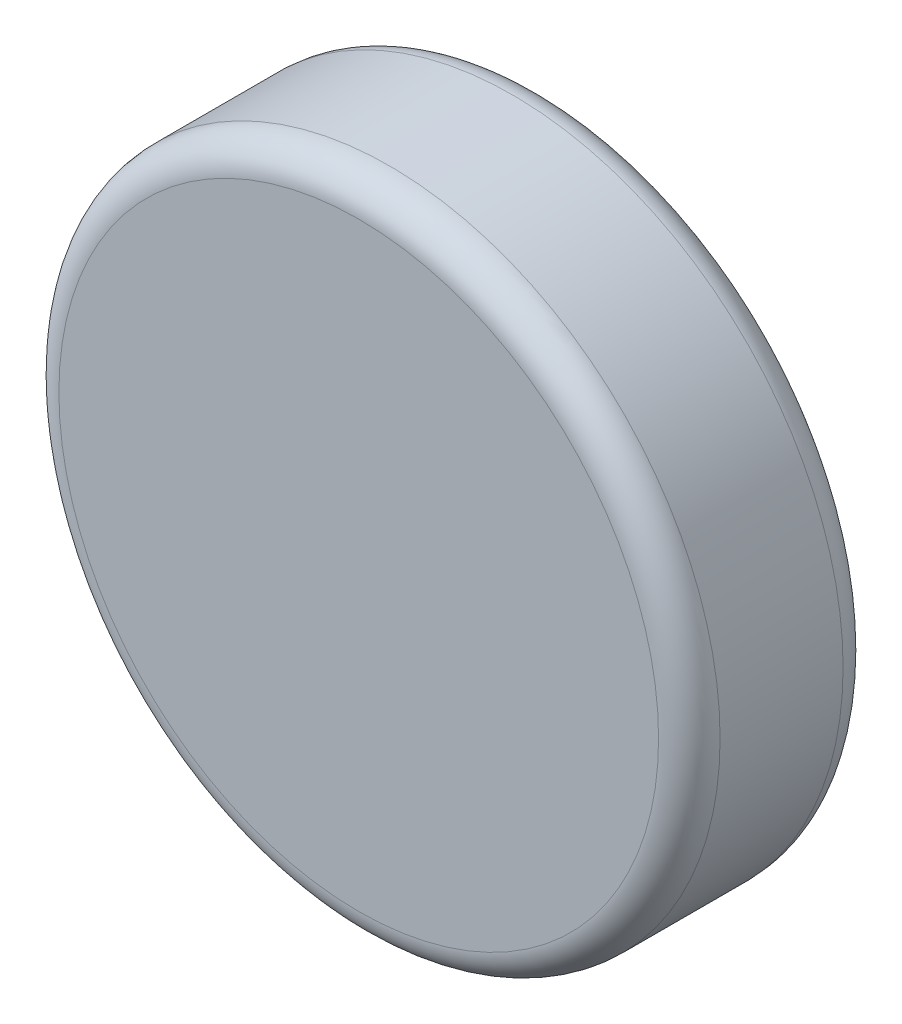
from build123d import *

# Parameters (mm, degrees)
ESQUISSE1_R        = 10.75
BOSS_EXTRU_1_DEPTH = 6
ESQUISSE3_R        = 0.7
BOSS_EXTRU_2_DEPTH = 3
CONG_1_R           = 1


with BuildPart() as part:
    # Esquisse1 → Boss.-Extru.1 (new body)
    with BuildSketch(Plane.XY):
        Circle(ESQUISSE1_R)
    extrude(amount=BOSS_EXTRU_1_DEPTH)

    # Esquisse3 → Boss.-Extru.2 (add)
    with BuildSketch(Plane(origin=(0, 0, 0), x_dir=(-1, 0, 0), z_dir=(0, 0, -1))):
        with Locations(Location((-2.5, 0, 0), (0, 0, 180))):
            Circle(ESQUISSE3_R)
        with Locations(Location((2.5, 0, 0), (0, 0, 180))):
            Circle(ESQUISSE3_R)
    extrude(amount=BOSS_EXTRU_2_DEPTH)

    # Congé1
    cong_1_edges = [part.edges().sort_by_distance(p)[0] for p in [
        (-10.75, 0, 0),
        (-10.75, 0, 6),
    ]]
    fillet(cong_1_edges, radius=CONG_1_R)


solid = part.part
